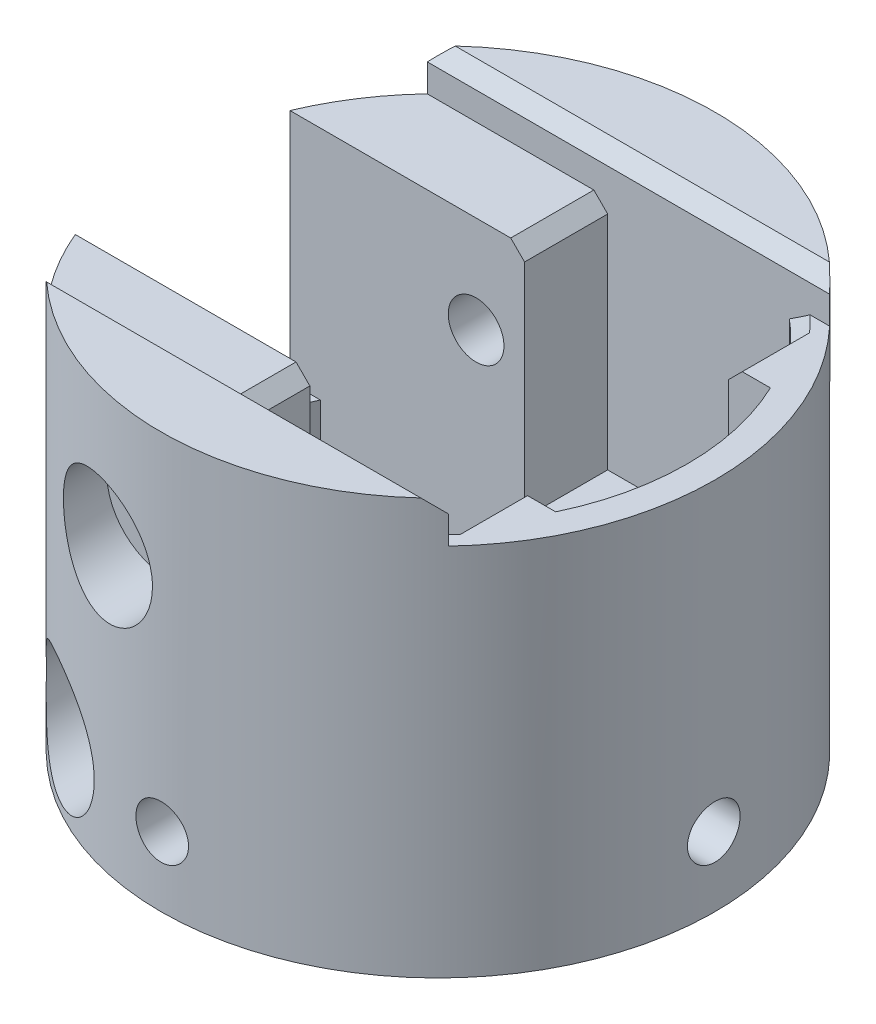
from build123d import *
from build123d.topology import SkipClean

# Parameters (mm, degrees)
SKETCH1_R               = 25.4
BASE_RING_DEPTH         = 12.7
SET_SCREW_R             = 2.413
SET_SCREW_HOLE_DEPTH    = 19.05
SET_SCREW_PATTERN_COUNT = 3
SET_SCREW_PATTERN_ANGLE = 180
UPPER_SECTION_DEPTH     = 21.59
LOWER_AXLE_D            = 5.1054
LOWER_AXLE_DEPTH        = 15.5575
LOWER_AXLE_CBORE_D      = 11.1125
LOWER_AXLE_CBORE_DEPTH  = 10.7442
UPPER_AXLE_D            = 5.1054
UPPER_AXLE_DEPTH        = 15.5575
UPPER_AXLE_CBORE_D      = 11.1125
UPPER_AXLE_CBORE_DEPTH  = 6.9342
SERVO_PLATE_SCREW_REACH = 51.66
SKETCH10_R              = 2.413
NUT_HOLE_DEPTH          = 2.54
LOWER_NUT_HOLE_DEPTH    = 2.54
FRONT_NUT_HOLE_DEPTH    = 2.54
FLUSH_PLATE_DEPTH       = 3.81
LEAD_IN_CHAMFER_SIZE    = 1.27


with BuildPart() as part:
    # Sketch1 → base_ring (new body)
    with BuildSketch(Plane(origin=(0, 0, 0), x_dir=(1, 0, 0), z_dir=(0, 1, 0))):
        with Locations(Location((0, 0, 0), (0, 0, 270))):
            Circle(SKETCH1_R)
        with BuildLine():
            Line((-1.905, 9.8425), (-20.632614806, 9.8425))
            ThreePointArc((-20.632614806, 9.8425), (-22.86, 0), (-20.632614806, -9.8425))
            Line((-20.632614806, -9.8425), (-1.905, -9.8425))
            Line((-1.905, -9.8425), (16.784650397, -9.8425))
            Line((16.784650397, -9.8425), (16.784650397, 9.8425))
            Line((16.784650397, 9.8425), (-1.905, 9.8425))
        make_face(mode=Mode.SUBTRACT)
    extrude(amount=BASE_RING_DEPTH)

    # set_screw → set_screw_hole (cut)
    with BuildSketch(Plane.XY.offset(25.4)):
        with Locations((0, 6.35)):
            Circle(SET_SCREW_R)
    set_screw_hole = extrude(amount=-SET_SCREW_HOLE_DEPTH, mode=Mode.SUBTRACT)

    # set_screw_pattern: set_screw_hole ×3 about axis
    set_screw_pattern_axis = Axis((0, 12.7, 0), (0, 1, 0))
    for i in range(1, SET_SCREW_PATTERN_COUNT):
        add(set_screw_hole.rotate(set_screw_pattern_axis, i * SET_SCREW_PATTERN_ANGLE / (SET_SCREW_PATTERN_COUNT - 1)), mode=Mode.SUBTRACT)

    # Sketch6 → upper_section (add)
    with BuildSketch(Plane(origin=(0, 12.7, 0), x_dir=(1, 0, 0), z_dir=(0, 1, 0))):
        with BuildLine():
            Line((-23.415490466, 9.8425), (-1.905, 9.8425))
            Line((-1.905, 9.8425), (-1.905, 17.4625))
            Line((-1.905, 17.4625), (14.752650397, 17.4625))
            ThreePointArc((14.752650397, 17.4625), (15.79854868, 16.522271624), (16.784650397, 15.519507435))
            Line((16.784650397, 15.519507435), (16.784650397, 9.8425))
            Line((16.784650397, 9.8425), (20.632614806, 9.8425))
            ThreePointArc((20.632614806, 9.8425), (22.86, 0), (20.632614806, -9.8425))
            Line((20.632614806, -9.8425), (16.784650397, -9.8425))
            Line((16.784650397, -9.8425), (16.784650397, -15.519507435))
            ThreePointArc((16.784650397, -15.519507435), (15.79854868, -16.522271624), (14.752650397, -17.4625))
            Line((14.752650397, -17.4625), (-1.905, -17.4625))
            Line((-1.905, -17.4625), (-1.905, -9.8425))
            Line((-1.905, -9.8425), (-23.415490466, -9.8425))
            ThreePointArc((-23.415490466, -9.8425), (25.4, 0), (-23.415490466, 9.8425))
        make_face()
    extrude(amount=UPPER_SECTION_DEPTH)

    # lower_axle
    with Locations(Plane.XY.offset(25.4)):
        with Locations((-12.7, 6.35)):
            lower_axle = CounterBoreHole(LOWER_AXLE_D / 2, LOWER_AXLE_CBORE_D / 2, LOWER_AXLE_CBORE_DEPTH, depth=LOWER_AXLE_DEPTH)

    # upper_axle
    with Locations(Plane.XY.offset(25.4)):
        with Locations((-6.35, 25.4)):
            upper_axle = CounterBoreHole(UPPER_AXLE_D / 2, UPPER_AXLE_CBORE_D / 2, UPPER_AXLE_CBORE_DEPTH, depth=UPPER_AXLE_DEPTH)

    # Sketch10 → servo_plate_screw (cut, up to next)
    with BuildSketch(Plane.XZ, mode=Mode.PRIVATE) as servo_plate_screw_sk1:
        with Locations(Location((8.89, 13.97, 0), (0, 0, 270))):
            Circle(SKETCH10_R)
    servo_plate_screw_tool1 = extrude(servo_plate_screw_sk1.sketch, amount=-SERVO_PLATE_SCREW_REACH, mode=Mode.PRIVATE) & part.part
    servo_plate_screw = servo_plate_screw_tool1.solids().sort_by_distance((8.89, 0, 13.97))[0]
    add(servo_plate_screw, mode=Mode.SUBTRACT)

    # Sketch11 → nut_hole (cut, symmetric)
    with BuildSketch(Plane(origin=(0, 12.7, 0), x_dir=(1, 0, 0), z_dir=(0, 1, 0))):
        Polygon((14.755878735, -13.97), (11.822939367, -8.89), (5.957060633, -8.89), (3.024121265, -13.97), (5.957060633, -19.05), (11.822939367, -19.05), align=None)
    nut_hole = extrude(amount=NUT_HOLE_DEPTH, both=True, mode=Mode.SUBTRACT)

    # Sketch12 → lower_nut_hole (cut)
    with BuildSketch(Plane(origin=(0, 0, 9.8425), x_dir=(-1, 0, 0), z_dir=(0, 0, -1))):
        Polygon((5.08, 3.417060633), (5.08, 9.282939367), (0, 12.215878735), (-5.08, 9.282939367), (-5.08, 3.417060633), (0, 0.484121265), align=None)
    lower_nut_hole = extrude(amount=-LOWER_NUT_HOLE_DEPTH, mode=Mode.SUBTRACT)

    # Sketch13 → front_nut_hole (cut)
    with BuildSketch(Plane.ZY.offset(-16.784650397)):
        Polygon((0, 12.215878735), (-5.08, 9.282939367), (-5.08, 3.417060633), (0, 0.484121265), (5.08, 3.417060633), (5.08, 9.282939367), align=None)
    extrude(amount=-FRONT_NUT_HOLE_DEPTH, mode=Mode.SUBTRACT)

    # screw_mirror: lower_axle, upper_axle, servo_plate_screw, nut_hole, lower_nut_hole across plane
    add(lower_axle.mirror(Plane.XY), mode=Mode.SUBTRACT)
    add(upper_axle.mirror(Plane.XY), mode=Mode.SUBTRACT)
    add(servo_plate_screw.mirror(Plane.XY), mode=Mode.SUBTRACT)
    add(nut_hole.mirror(Plane.XY), mode=Mode.SUBTRACT)
    add(lower_nut_hole.mirror(Plane.XY), mode=Mode.SUBTRACT)

    # Sketch9 → flush_plate (add)
    with SkipClean():  # the faces are left unmerged after this step: merging them gives an invalid solid
        with BuildSketch(Plane(origin=(0, 34.29, 0), x_dir=(1, 0, 0), z_dir=(0, 1, 0))):
            with BuildLine():
                Line((-18.445083186, 17.4625), (18.445083186, 17.4625))
                ThreePointArc((18.445083186, 17.4625), (0, 25.4), (-18.445083186, 17.4625))
            make_face()
            with BuildLine():
                Line((-18.445083186, -17.4625), (18.445083186, -17.4625))
                ThreePointArc((18.445083186, -17.4625), (0, -25.4), (-18.445083186, -17.4625))
            make_face()
        extrude(amount=FLUSH_PLATE_DEPTH)

    # lead_in_chamfer
    lead_in_chamfer_edges = [part.edges().sort_by_distance(p)[0] for p in [
        (0, 38.1, -17.4625),
        (0, 38.1, 17.4625),
        (-1.905, 34.29, -13.6525),
        (15.79854868, 34.29, -16.522271624),
        (16.784650397, 34.29, -12.681003718),
        (16.784650397, 34.29, 12.681003718),
        (15.79854868, 34.29, 16.522271624),
        (-1.905, 34.29, 13.6525),
    ]]
    chamfer(lead_in_chamfer_edges, length=LEAD_IN_CHAMFER_SIZE)


solid = part.part
